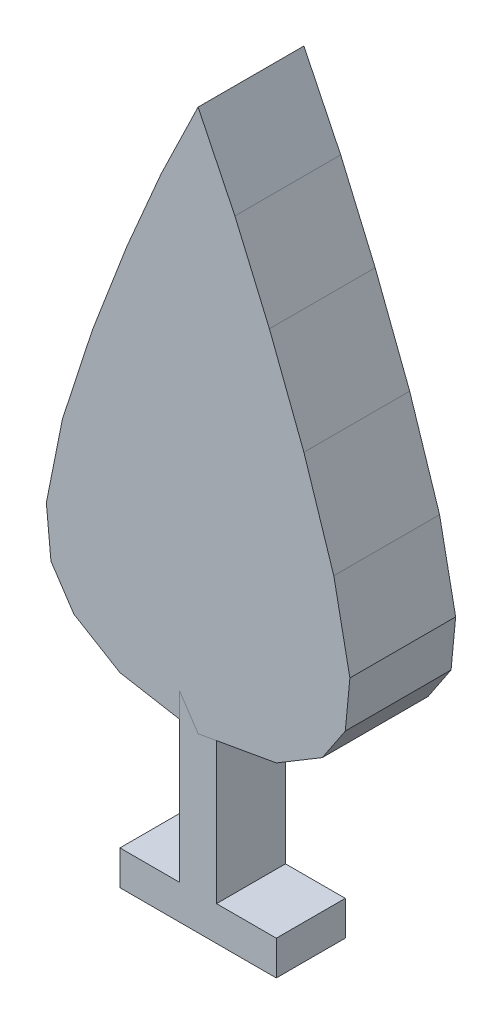
from build123d import *

# Parameters (mm, degrees)
SKETCH_2_W      = 16
SKETCH_2_H      = 92
EXTRUDE_2_DEPTH = 30
EXTRUDE_3_DEPTH = 46
SKETCH_4_W      = 68
SKETCH_4_H      = 30
EXTRUDE_4_DEPTH = 15


with BuildPart() as part:
    # 草图2 → 凸台-拉伸2 (new body)
    with BuildSketch(Plane.XY):
        with Locations((0, -45)):
            Rectangle(SKETCH_2_W, SKETCH_2_H)
    extrude(amount=-EXTRUDE_2_DEPTH)

    # 草图4 → 凸台-拉伸4 (add)
    with BuildSketch(Plane.XZ.offset(91)):
        with Locations((0, -15)):
            Rectangle(SKETCH_4_W, SKETCH_4_H)
    extrude(amount=EXTRUDE_4_DEPTH)


with BuildPart() as body_2:
    # 草图3 → 凸台-拉伸3 (new body)
    with BuildSketch(Plane.XY):
        Polygon((0, 205), (16, 172), (31, 137), (46, 98), (59, 58), (66, 23), (64, 2), (54, -13), (34, -25), (0, -31), (-34, -25), (-54, -13), (-64, 2), (-66, 23), (-59, 58), (-46, 98), (-31, 137), (-16, 172), align=None)
    extrude(amount=-EXTRUDE_3_DEPTH)


solid = Compound([part.part, body_2.part])
